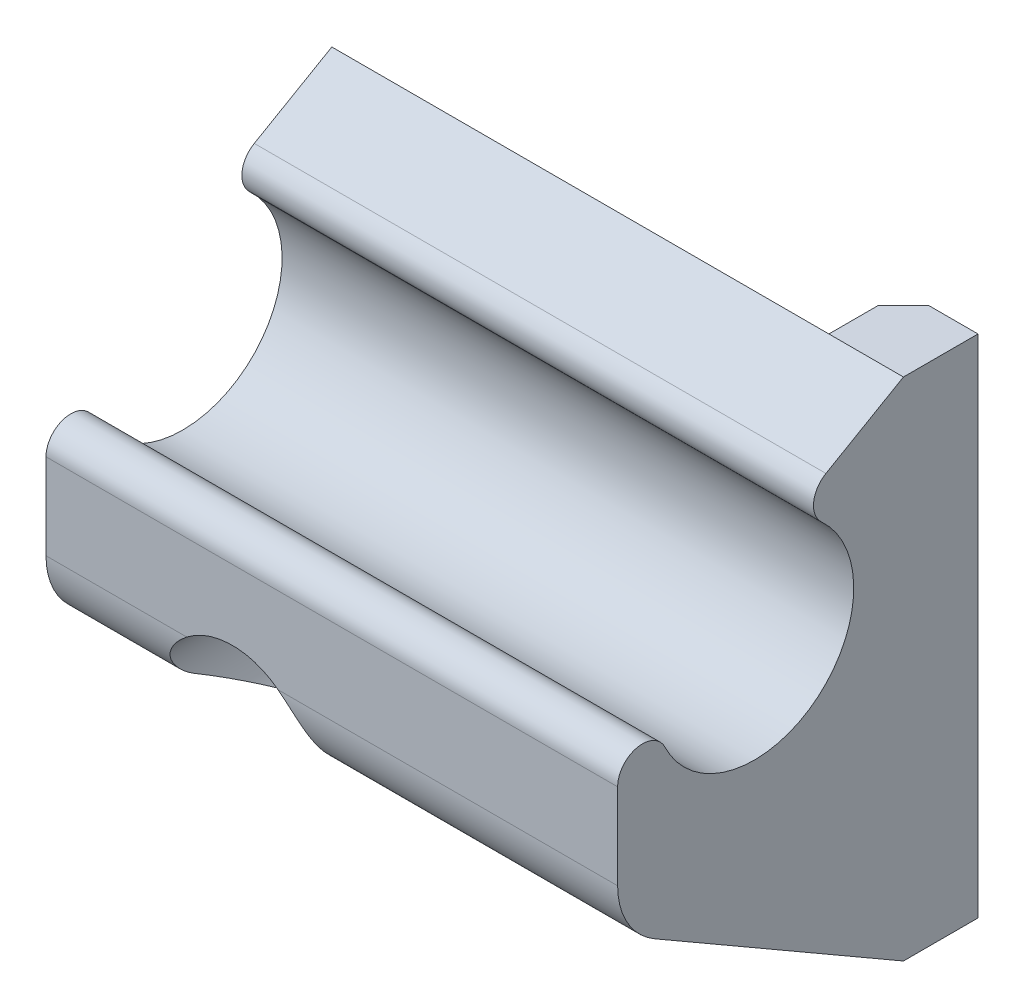
from build123d import *

# Parameters (mm, degrees)
EXTRUDE_1_DEPTH      = 15.5
EXTRUDE_1_DEPTH_BACK = 7.5
SKETCH_2_R           = 1.6
CUT_EXTRUDE_1_DEPTH  = 25.050924737
SKETCH_3_R           = 3
CUT_EXTRUDE_2_DEPTH  = 6
SKETCH_4_W           = 3
SKETCH_4_H           = 20.350852961
EXTRUDE_2_DEPTH      = 3
FILLET_1_R           = 3
CHAMFER_2_SIZE       = 1


with BuildPart() as part:
    # 草图1 → 凸台-拉伸1 (new, two sides: drawn at the far end of the back side and taken through both)
    with BuildSketch(Plane(origin=(0, 0, 0), x_dir=(0, 0, -1), z_dir=(1, 0, 0)).offset(-EXTRUDE_1_DEPTH_BACK)):
        with BuildLine():
            Line((0, 0), (0, 14.350852961))
            Line((0, 14.350852961), (-3.11932209, 12.549911513))
            ThreePointArc((-3.11932209, 12.549911513), (-3.613338081, 11.79312076), (-3.295457672, 10.947108887))
            ThreePointArc((-3.295457672, 10.947108887), (-3.612312045, 4.790802869), (-9.6, 6.256440423))
            ThreePointArc((-9.6, 6.256440423), (-10.723606798, 6.795229963), (-11.5, 5.820550528))
            Line((-11.5, 5.820550528), (-11.5, 0.639528096))
            Line((-11.5, 0.639528096), (0, -6))
            Line((0, -6), (0, 0))
        make_face()
    extrude(amount=EXTRUDE_1_DEPTH + EXTRUDE_1_DEPTH_BACK)

    # 草图2 → 切除-拉伸1 (cut, through all)
    with BuildSketch(Plane.XY.offset(11.5)):
        Circle(SKETCH_2_R)
    extrude(amount=-CUT_EXTRUDE_1_DEPTH, mode=Mode.SUBTRACT)

    # 草图3 → 切除-拉伸2 (cut)
    with BuildSketch(Plane.XY.offset(11.5)):
        Circle(SKETCH_3_R)
    extrude(amount=-CUT_EXTRUDE_2_DEPTH, mode=Mode.SUBTRACT)

    # 草图4 → 凸台-拉伸2 (add)
    with BuildSketch(Plane(origin=(0, 0, 0), x_dir=(-1, 0, 0), z_dir=(0, 0, -1))):
        with Locations((-14, 4.175426481)):
            Rectangle(SKETCH_4_W, SKETCH_4_H)
    extrude(amount=EXTRUDE_2_DEPTH)

    # 圆角1
    fillet_1_edges = [part.edges().sort_by_distance(p)[0] for p in [
        (9.215520711, 0.639528096, 11.5),
        (-5.215520711, 0.639528096, 11.5),
    ]]
    fillet(fillet_1_edges, radius=FILLET_1_R)

    # 倒角2
    chamfer_2_edges = [part.edges().sort_by_distance(p)[0] for p in [
        (12.5, 4.175426481, -3),
    ]]
    chamfer(chamfer_2_edges, length=CHAMFER_2_SIZE)


solid = part.part
